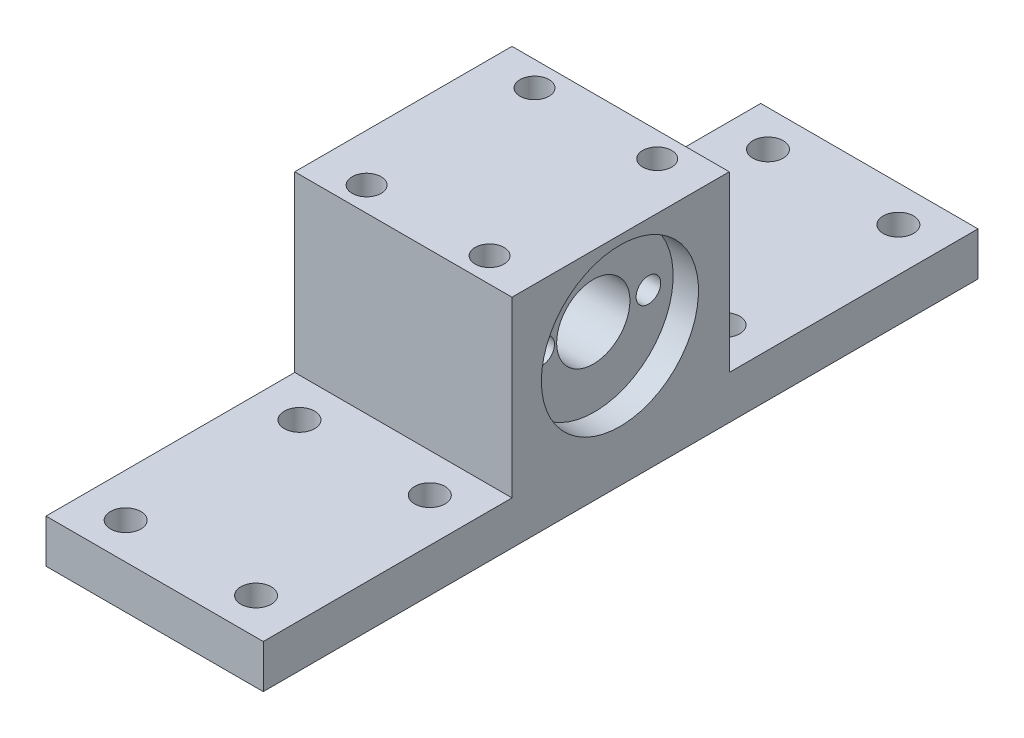
from build123d import *

# Parameters (mm, degrees)
SKETCH_1_R               = 5.06
SKETCH_1_R_2             = 1.7
EXTRUDE_2_DEPTH          = 30
CUT_EXTRUDE_1_DEPTH      = 63.561467357
CUT_EXTRUDE_1_DEPTH_BACK = 63.561467357
SKETCH_3_R               = 2.1
CUT_EXTRUDE_2_DEPTH      = 62.283268979
CUT_EXTRUDE_2_DEPTH_BACK = 3.5
SKETCH_6_R               = 10.85
SKETCH_7_R               = 10.85
CUT_EXTRUDE_3_DEPTH      = 3.5
SKETCH_8_R               = 2
CUT_EXTRUDE_4_DEPTH      = 10


with BuildPart() as part:
    # Эскиз1 → Бобышка-Вытянуть2 (new body)
    with BuildSketch(Plane(origin=(0, 0, 0), x_dir=(0, 0, -1), z_dir=(1, 0, 0))):
        Polygon((15.028471622, 20.43775572), (15.028471622, -3.56224428), (49.375471622, -3.56224428), (49.375471622, -9.56224428), (-49.318528378, -9.56224428), (-49.318528378, -3.56224428), (-14.971528378, -3.56224428), (-14.971528378, 20.43775572), align=None)
        with Locations((-0.246661602, 8.38775572)):
            Circle(SKETCH_1_R, mode=Mode.SUBTRACT)
        with Locations((7.363604846, 8.38775572)):
            Circle(SKETCH_1_R_2, mode=Mode.SUBTRACT)
        with Locations((-7.306661602, 8.38775572)):
            Circle(SKETCH_1_R_2, mode=Mode.SUBTRACT)
    extrude(amount=EXTRUDE_2_DEPTH)

    # Эскиз3 → Вырез-Вытянуть1 (cut, two sides: drawn at the far end of the back side and taken through both)
    with BuildSketch(Plane(origin=(0, -3.56224428, 0), x_dir=(1, 0, 0), z_dir=(0, 1, 0)).offset(-CUT_EXTRUDE_1_DEPTH_BACK)):
        with Locations(Location((6, -20.318528378, 0), (0, 0, 270))):
            Circle(SKETCH_3_R)
        with Locations(Location((24, -20.318528378, 0), (0, 0, 270))):
            Circle(SKETCH_3_R)
        with Locations(Location((24, -44.318528378, 0), (0, 0, 270))):
            Circle(SKETCH_3_R)
        with Locations(Location((6, -44.318528378, 0), (0, 0, 270))):
            Circle(SKETCH_3_R)
        with Locations(Location((6, 44.375471622, 0), (0, 0, 90))):
            Circle(SKETCH_3_R)
        with Locations(Location((24, 44.375471622, 0), (0, 0, 90))):
            Circle(SKETCH_3_R)
        with Locations(Location((24, 20.375471622, 0), (0, 0, 90))):
            Circle(SKETCH_3_R)
        with Locations(Location((6, 20.375471622, 0), (0, 0, 90))):
            Circle(SKETCH_3_R)
    extrude(amount=CUT_EXTRUDE_1_DEPTH + CUT_EXTRUDE_1_DEPTH_BACK, mode=Mode.SUBTRACT)

    # Эскиз6 → Вырез-Вытянуть2 (cut, two sides: drawn at the far end of the back side and taken through both)
    with BuildSketch(Plane(origin=(30, 0, 0), x_dir=(0, 0, -1), z_dir=(1, 0, 0)).offset(-CUT_EXTRUDE_2_DEPTH_BACK)):
        with Locations(Location((-0.067919336, 8.365106346, 0), (0, 0, 180))):
            Circle(SKETCH_6_R)
    extrude(amount=CUT_EXTRUDE_2_DEPTH + CUT_EXTRUDE_2_DEPTH_BACK, mode=Mode.SUBTRACT)

    # Эскиз7 → Вырез-Вытянуть3 (cut)
    with BuildSketch(Plane.ZY):
        with Locations((0.246661602, 8.38775572)):
            Circle(SKETCH_7_R)
    extrude(amount=-CUT_EXTRUDE_3_DEPTH, mode=Mode.SUBTRACT)

    # Эскиз8 → Вырез-Вытянуть4 (cut)
    with BuildSketch(Plane(origin=(0, 20.43775572, 0), x_dir=(1, 0, 0), z_dir=(0, 1, 0))):
        with Locations(Location((6.529067928, 11.609424623, 0), (0, 0, 270))):
            Circle(SKETCH_8_R)
        with Locations(Location((23.470932072, 11.609424623, 0), (0, 0, 90))):
            Circle(SKETCH_8_R)
        with Locations(Location((23.492925715, -11.564853382, 0), (0, 0, 270))):
            Circle(SKETCH_8_R)
        with Locations(Location((6.55109209, -11.597010844, 0), (0, 0, 90))):
            Circle(SKETCH_8_R)
    extrude(amount=-CUT_EXTRUDE_4_DEPTH, mode=Mode.SUBTRACT)


solid = part.part
